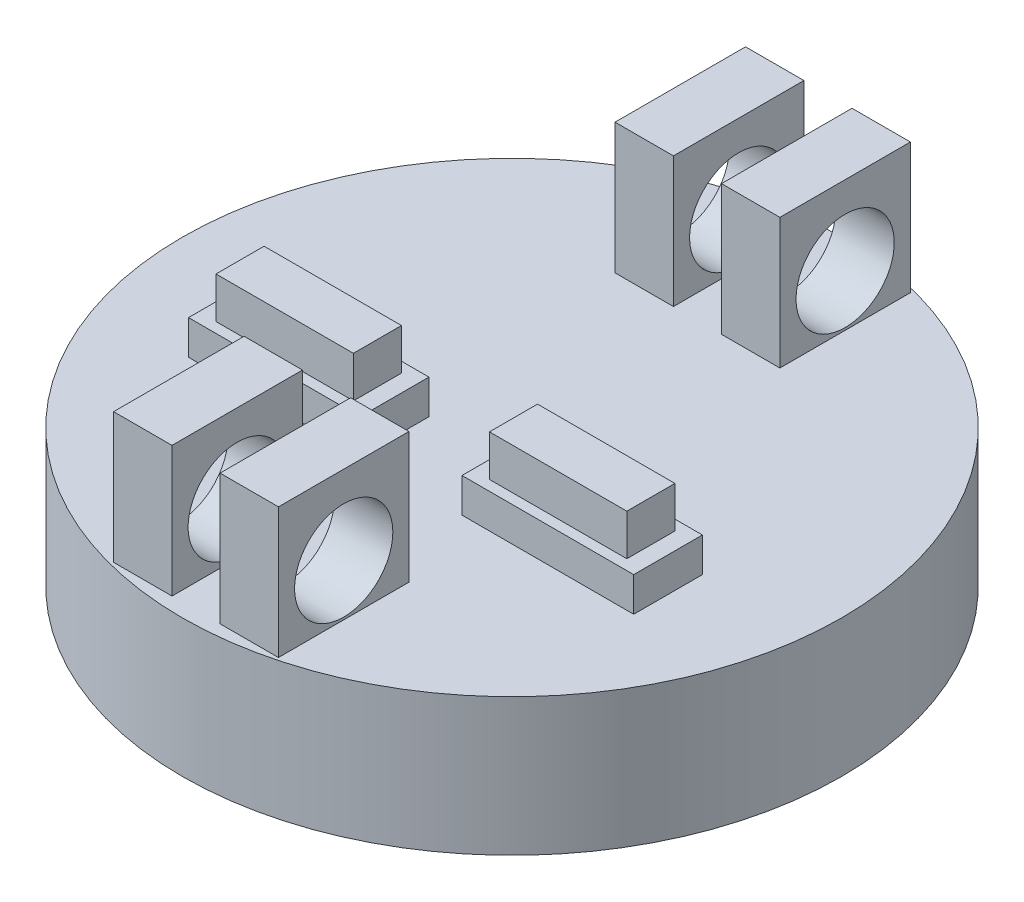
from build123d import *

# Parameters (mm, degrees)
SKETCH3_R           = 48
BOSS_EXTRUDE2_DEPTH = 20
SKETCH4_W           = 25
SKETCH4_H           = 5
SKETCH4_H_2         = 10
BOSS_EXTRUDE4_DEPTH = 5
SKETCH5_W           = 20
SKETCH5_H           = 7
BOSS_EXTRUDE5_DEPTH = 6
SKETCH6_W           = 24
SKETCH6_H           = 19
BOSS_EXTRUDE6_DEPTH = 19
SKETCH7_R           = 7.15
CUT_EXTRUDE1_DEPTH  = 28
SKETCH8_W           = 3.5
SKETCH8_H           = 19
SKETCH8_W_2         = 7
CUT_EXTRUDE2_DEPTH  = 19


with BuildPart() as part:
    # Sketch3 → Boss-Extrude2 (new body)
    with BuildSketch(Plane(origin=(0, 0, 0), x_dir=(1, 0, 0), z_dir=(0, 1, 0))):
        with Locations(Location((0, 0, 0), (0, 0, 270))):
            Circle(SKETCH3_R)
    extrude(amount=BOSS_EXTRUDE2_DEPTH)

    # Sketch4 → Boss-Extrude4 (add)
    with BuildSketch(Plane(origin=(0, 20, 0), x_dir=(1, 0, 0), z_dir=(0, 1, 0))):
        with Locations((-19.905756196, -7.187203126)):
            Rectangle(SKETCH4_W, SKETCH4_H)
        with Locations((-19.905756196, -12.187203126)):
            Rectangle(SKETCH4_W, SKETCH4_H)
        with Locations((19.905756196, -9.687203126)):
            Rectangle(SKETCH4_W, SKETCH4_H_2)
    extrude(amount=BOSS_EXTRUDE4_DEPTH)

    # Sketch5 → Boss-Extrude5 (add)
    with BuildSketch(Plane(origin=(0, 25, 0), x_dir=(1, 0, 0), z_dir=(0, 1, 0))):
        with Locations((19.905756196, -9.687203126)):
            Rectangle(SKETCH5_W, SKETCH5_H)
        with Locations((-19.905756196, -9.687203126)):
            Rectangle(SKETCH5_W, SKETCH5_H)
    extrude(amount=BOSS_EXTRUDE5_DEPTH)

    # Sketch6 → Boss-Extrude6 (add)
    with BuildSketch(Plane(origin=(0, 20, 0), x_dir=(1, 0, 0), z_dir=(0, 1, 0))):
        with Locations((0, -36.5)):
            Rectangle(SKETCH6_W, SKETCH6_H)
        with Locations((0, 36.5)):
            Rectangle(SKETCH6_W, SKETCH6_H)
    extrude(amount=BOSS_EXTRUDE6_DEPTH)

    # Sketch7 → Cut-Extrude1 (cut)
    with BuildSketch(Plane(origin=(12, 0, 0), x_dir=(0, 0, -1), z_dir=(1, 0, 0))):
        with Locations((-36.5, 27.5)):
            Circle(SKETCH7_R)
        with Locations(Location((36.5, 27.5, 0), (0, 0, 180))):
            Circle(SKETCH7_R)
    extrude(amount=-CUT_EXTRUDE1_DEPTH, mode=Mode.SUBTRACT)

    # Sketch8 → Cut-Extrude2 (cut)
    with BuildSketch(Plane(origin=(0, 39, 0), x_dir=(1, 0, 0), z_dir=(0, 1, 0))):
        with Locations((-1.75, -36.5)):
            Rectangle(SKETCH8_W, SKETCH8_H)
        with Locations((1.75, -36.5)):
            Rectangle(SKETCH8_W, SKETCH8_H)
        with Locations((0, 36.5)):
            Rectangle(SKETCH8_W_2, SKETCH8_H)
    extrude(amount=-CUT_EXTRUDE2_DEPTH, mode=Mode.SUBTRACT)


solid = part.part
